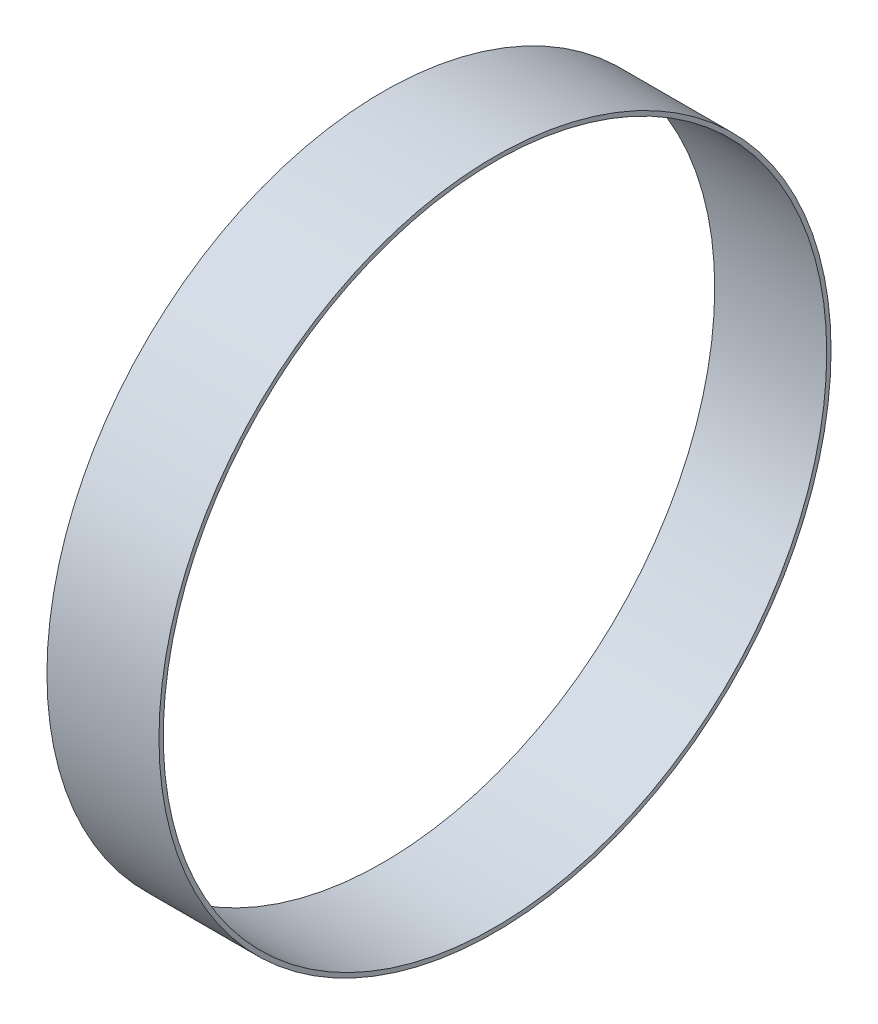
from build123d import *

# Parameters (mm, degrees)
SKETCH2_R           = 76.2
BOSS_EXTRUDE1_DEPTH = 25.4
SKETCH3_R           = 75.2221
CUT_EXTRUDE1_DEPTH  = 111.716033166


with BuildPart() as part:
    # Sketch2 → Boss-Extrude1 (new body)
    with BuildSketch(Plane(origin=(0, 0, 0), x_dir=(0, 0, -1), z_dir=(1, 0, 0))):
        Circle(SKETCH2_R)
    extrude(amount=BOSS_EXTRUDE1_DEPTH)

    # Sketch3 → Cut-Extrude1 (cut, through all)
    with BuildSketch(Plane(origin=(25.4, 0, 0), x_dir=(0, 0, -1), z_dir=(1, 0, 0))):
        Circle(SKETCH3_R)
    extrude(amount=-CUT_EXTRUDE1_DEPTH, mode=Mode.SUBTRACT)


solid = part.part
